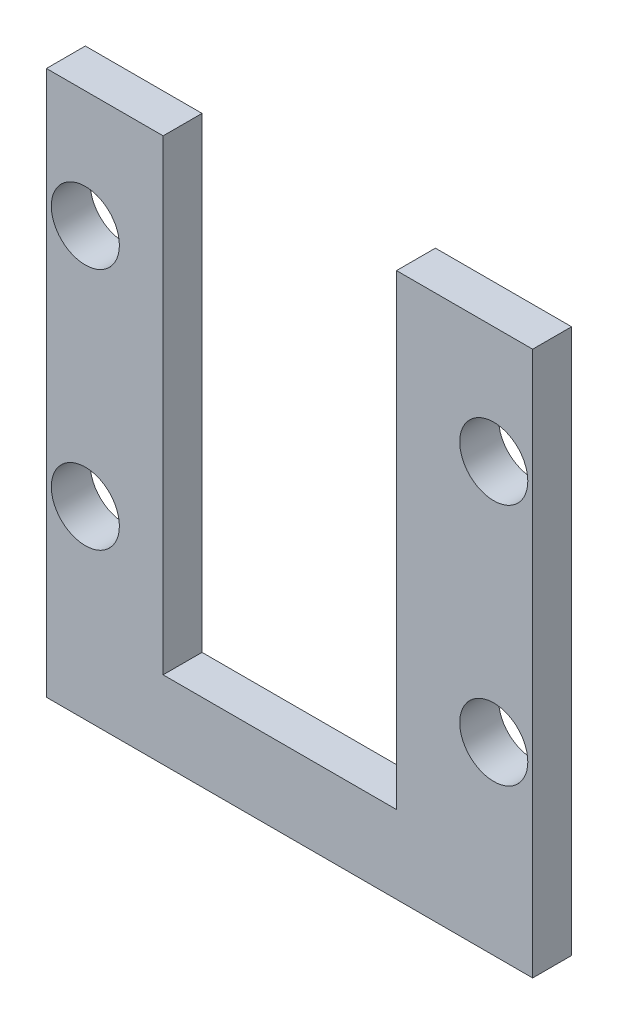
from build123d import *

# Parameters (mm, degrees)
SKETCH_1_R      = 1.75
SKETCH_1_W      = 6
SKETCH_1_H      = 4
SKETCH_1_W_2    = 7
EXTRUDE_6_DEPTH = 2


with BuildPart() as part:
    # ｽｹｯﾁ1 → ﾎﾞｽ - 押し出し6 (new body)
    # profile 1 of 3: a face of its own
    with BuildSketch(Plane.XY):
        Polygon((18, 24), (25, 24), (25, 0), (0, 0), (0, 24), (6, 24), (6, 4), (18, 4), align=None)
        with Locations((23, 9.5)):
            Circle(SKETCH_1_R, mode=Mode.SUBTRACT)
        with Locations((2, 9.5)):
            Circle(SKETCH_1_R, mode=Mode.SUBTRACT)
        with Locations((23, 22)):
            Circle(SKETCH_1_R, mode=Mode.SUBTRACT)
        with Locations((2, 22)):
            Circle(SKETCH_1_R, mode=Mode.SUBTRACT)
    # profile 2 of 3: a face of its own
    with BuildSketch(Plane.XY):
        with Locations((3, 26)):
            Rectangle(SKETCH_1_W, SKETCH_1_H)
    # profile 3 of 3: a face of its own
    with BuildSketch(Plane.XY):
        with Locations((21.5, 26)):
            Rectangle(SKETCH_1_W_2, SKETCH_1_H)
    extrude(amount=EXTRUDE_6_DEPTH)


solid = part.part
